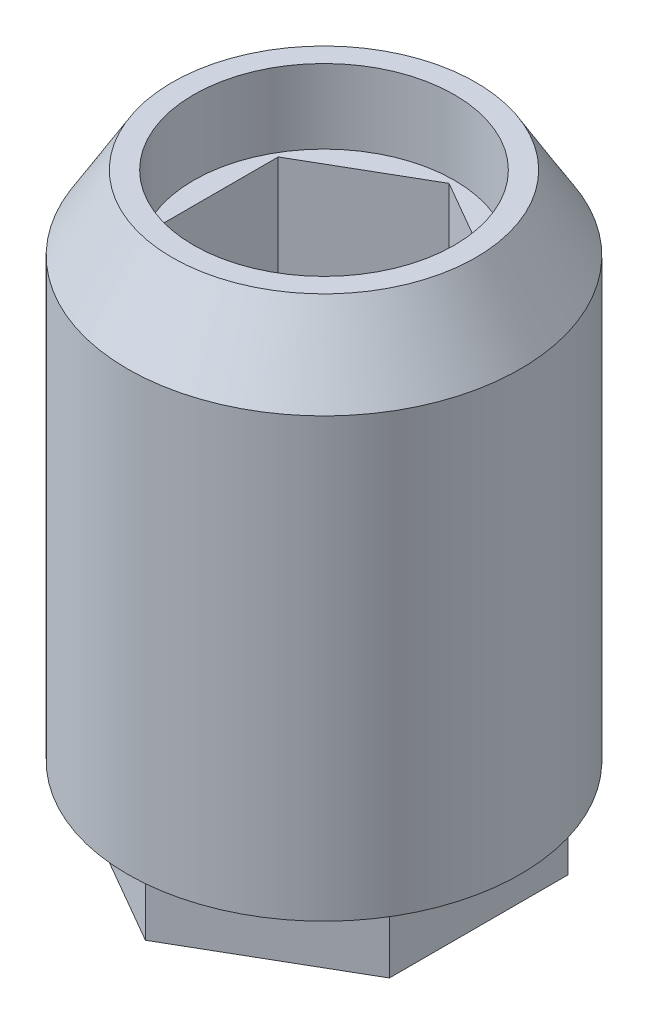
from build123d import *

# Parameters (mm, degrees)
SKETCH_1_R          = 8.5
SKETCH_2_R          = 11
SKETCH_4_R          = 11
CUT_EXTRUDE_1_DEPTH = 36.89599575
SKETCH_10_R         = 7
SKETCH_9_R          = 7
CUT_EXTRUDE_START   = -4.15
SKETCH_12_R         = 7.3
CUT_EXTRUDE_4_DEPTH = 4.15


with BuildPart() as part:
    # Эскиз1 → Loft 1 section 0
    with BuildSketch(Plane(origin=(0, 0, 0), x_dir=(1, 0, 0), z_dir=(0, 1, 0))):
        Circle(SKETCH_1_R)
    # Эскиз2 → Loft 1 section 1
    with BuildSketch(Plane(origin=(0, -4.15, 0), x_dir=(1, 0, 0), z_dir=(0, 1, 0))):
        Circle(SKETCH_2_R)
    loft()

    # Эскиз4 → section 1 of loft_2
    with BuildSketch(Plane(origin=(0, -28.65, 0), x_dir=(1, 0, 0), z_dir=(0, 1, 0)), mode=Mode.PRIVATE) as loft_2_s1:
        Circle(SKETCH_4_R)
    # loft up to a face of the part (loft_2)
    loft([Face(Wire([part.edges().sort_by_distance((-7.530018165, -4.15, 8.018654902))[0]])), loft_2_s1.sketch])

    # Эскиз5 → По сечениям3 section 0
    with BuildSketch(Plane(origin=(0, -28.65, 0), x_dir=(1, 0, 0), z_dir=(0, 1, 0))):
        with BuildLine():
            Line((0, 10), (-8.660254038, 5))
            Line((-8.660254038, 5), (-8.660254038, -5))
            Line((-8.660254038, -5), (0, -10))
            Line((0, -10), (8.660254038, -5))
            Line((8.660254038, -5), (8.660254038, 5))
            Line((8.660254038, 5), (0, 10))
        make_face()
    # Эскиз7 → По сечениям3 section 1
    with BuildSketch(Plane(origin=(0, -32.35, 0), x_dir=(1, 0, 0), z_dir=(0, 1, 0))):
        with BuildLine():
            Line((0, 10), (-8.660254038, 5))
            Line((-8.660254038, 5), (-8.660254038, -5))
            Line((-8.660254038, -5), (0, -10))
            Line((0, -10), (8.660254038, -5))
            Line((8.660254038, -5), (8.660254038, 5))
            Line((8.660254038, 5), (0, 10))
        make_face()
    loft()

    # Эскиз8 → Вырез-Вытянуть1 (cut, through all)
    with BuildSketch(Plane.XZ.offset(32.35)):
        Polygon((-6.062177826, 3.5), (-6.062177826, -3.5), (0, -7), (6.062177826, -3.5), (6.062177826, 3.5), (0, 7), align=None)
    extrude(amount=-CUT_EXTRUDE_1_DEPTH, mode=Mode.SUBTRACT)

    # Эскиз10 → Loft 1 2 section 0
    with BuildSketch(Plane(origin=(0, -12, 0), x_dir=(1, 0, 0), z_dir=(0, 1, 0))):
        Circle(SKETCH_10_R)
    # Эскиз9 → Loft 1 2 section 1
    with BuildSketch(Plane(origin=(0, -20.35, 0), x_dir=(1, 0, 0), z_dir=(0, 1, 0))):
        Circle(SKETCH_9_R)
    loft(mode=Mode.SUBTRACT)

    # Эскиз12 → Вырез-Вытянуть4 (cut)
    with BuildSketch(Plane(origin=(0, 0, 0), x_dir=(1, 0, 0), z_dir=(0, 1, 0)).offset(CUT_EXTRUDE_START)):
        with Locations(Location((0, 0, 0), (0, 0, 270))):
            Circle(SKETCH_12_R)
    extrude(amount=CUT_EXTRUDE_4_DEPTH, mode=Mode.SUBTRACT)


solid = part.part
